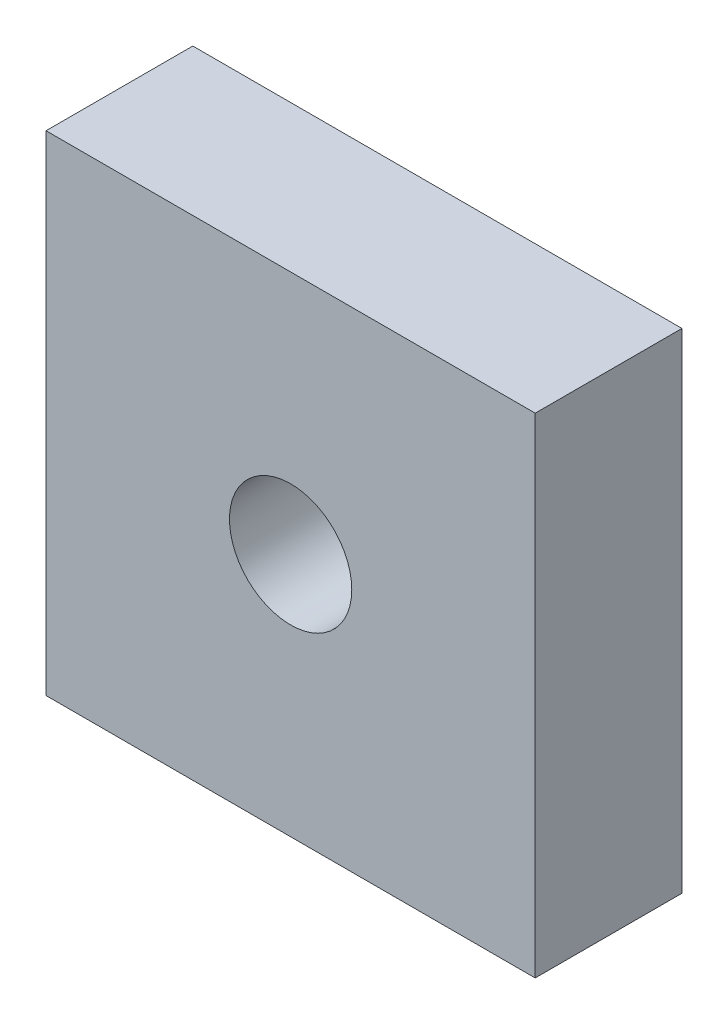
from build123d import *

# Parameters (mm, degrees)
ESBO_O1_W                = 20
ESBO_O1_H                = 20
ESBO_O1_R                = 2.5
RESSALTO_EXTRUS_O1_DEPTH = 6


with BuildPart() as part:
    # Esboço1 → Ressalto-extrusão1 (new body)
    with BuildSketch(Plane.XY):
        Rectangle(ESBO_O1_W, ESBO_O1_H)
        Circle(ESBO_O1_R, mode=Mode.SUBTRACT)
    extrude(amount=RESSALTO_EXTRUS_O1_DEPTH)


solid = part.part
